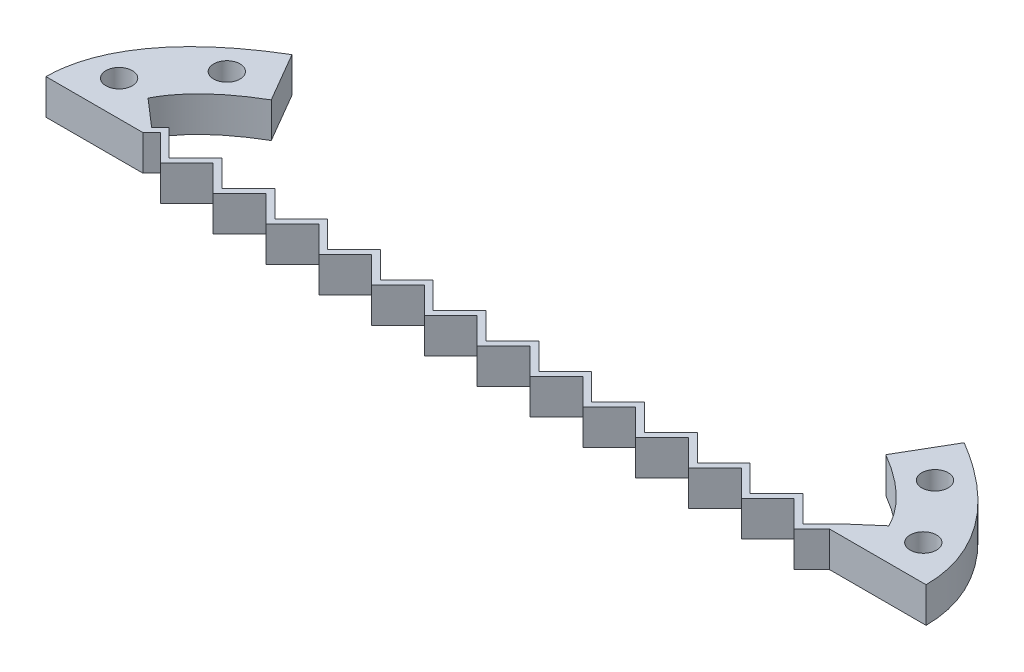
from build123d import *

# Parameters (mm, degrees)
SKETCH_1_R      = 1.5
EXTRUDE_1_DEPTH = 4


with BuildPart() as part:
    # Эскиз1 → Бобышка-Вытянуть1 (new body)
    with BuildSketch(Plane(origin=(0, 0, 0), x_dir=(1, 0, 0), z_dir=(0, 1, 0))):
        with BuildLine():
            Line((-50, 0), (-43, 0))
            Line((-43, 0), (-39, 0))
            Line((-39, 0), (-38, 1))
            Line((-38, 1), (-35, -2))
            Line((-35, -2), (-33, 0))
            Line((-33, 0), (-32, 1))
            Line((-32, 1), (-29, -2))
            Line((-29, -2), (-27, 0))
            Line((-27, 0), (-26, 1))
            Line((-26, 1), (-23, -2))
            Line((-23, -2), (-21, 0))
            Line((-21, 0), (-20, 1))
            Line((-20, 1), (-17, -2))
            Line((-17, -2), (-15, 0))
            Line((-15, 0), (-14, 1))
            Line((-14, 1), (-11, -2))
            Line((-11, -2), (-9, 0))
            Line((-9, 0), (-8, 1))
            Line((-8, 1), (-5, -2))
            Line((-5, -2), (-3, 0))
            Line((-3, 0), (-2, 1))
            Line((-2, 1), (1, -2))
            Line((1, -2), (3, 0))
            Line((3, 0), (4, 1))
            Line((4, 1), (7, -2))
            Line((7, -2), (9, 0))
            Line((9, 0), (10, 1))
            Line((10, 1), (13, -2))
            Line((13, -2), (15, 0))
            Line((15, 0), (16, 1))
            Line((16, 1), (19, -2))
            Line((19, -2), (21, 0))
            Line((21, 0), (22, 1))
            Line((22, 1), (25, -2))
            Line((25, -2), (27, 0))
            Line((27, 0), (28, 1))
            Line((28, 1), (31, -2))
            Line((31, -2), (33, 0))
            Line((33, 0), (34, 1))
            Line((34, 1), (37, -2))
            Line((37, -2), (39, 0))
            Line((39, 0), (43, 0))
            Line((43, 0), (50, 0))
            add(Edge.make_bspline(
                [(50, 0), (50, 9.148701546), (38.189799805, 16.136443156)],
                knots=[6.270008338, 6.270008338, 6.270008338, 6.984807717, 6.984807717, 6.984807717], degree=2, weights=[0.818101322, 0.849400917, 1]))
            Line((38.189799805, 16.136443156), (34.912704057, 10.507753014))
            add(Edge.make_bspline(
                [(42.090540855, 3.682445167), (40.227847319, 7.413208709), (34.912704057, 10.507753014)],
                knots=[0.206034906, 0.206034906, 0.206034906, 0.623356981, 0.623356981, 0.623356981], degree=2, weights=[1, 0.978309158, 1]))
            Line((42.090540855, 3.682445167), (39, 1))
            Line((39, 1), (37, -1))
            Line((37, -1), (34, 2))
            Line((34, 2), (33, 1))
            Line((33, 1), (31, -1))
            Line((31, -1), (28, 2))
            Line((28, 2), (27, 1))
            Line((27, 1), (25, -1))
            Line((25, -1), (22, 2))
            Line((22, 2), (21, 1))
            Line((21, 1), (19, -1))
            Line((19, -1), (16, 2))
            Line((16, 2), (15, 1))
            Line((15, 1), (13, -1))
            Line((13, -1), (10, 2))
            Line((10, 2), (9, 1))
            Line((9, 1), (7, -1))
            Line((7, -1), (4, 2))
            Line((4, 2), (3, 1))
            Line((3, 1), (1, -1))
            Line((1, -1), (-2, 2))
            Line((-2, 2), (-3, 1))
            Line((-3, 1), (-5, -1))
            Line((-5, -1), (-8, 2))
            Line((-8, 2), (-9, 1))
            Line((-9, 1), (-11, -1))
            Line((-11, -1), (-14, 2))
            Line((-14, 2), (-15, 1))
            Line((-15, 1), (-17, -1))
            Line((-17, -1), (-20, 2))
            Line((-20, 2), (-21, 1))
            Line((-21, 1), (-23, -1))
            Line((-23, -1), (-26, 2))
            Line((-26, 2), (-27, 1))
            Line((-27, 1), (-29, -1))
            Line((-29, -1), (-32, 2))
            Line((-32, 2), (-33, 1))
            Line((-33, 1), (-35, -1))
            Line((-35, -1), (-38, 2))
            Line((-38, 2), (-39, 1))
            Line((-39, 1), (-42.090540855, 3.682445167))
            add(Edge.make_bspline(
                [(-34.912704057, 10.507753014), (-40.227846573, 7.413208572), (-42.090540855, 3.682445167)],
                knots=[5.659828256, 5.659828256, 5.659828256, 6.077150244, 6.077150244, 6.077150244], degree=2, weights=[1, 0.978309167, 1]))
            Line((-34.912704057, 10.507753014), (-38.189799805, 16.136443156))
            add(Edge.make_bspline(
                [(-38.189799805, 16.136443156), (-50, 9.148701546), (-50, 0)],
                knots=[2.439970244, 2.439970244, 2.439970244, 3.141592654, 3.141592654, 3.141592654], degree=2, weights=[1, 0.939094243, 1]))
        make_face()
        with Locations(Location((-45.689262056, 3.997292475, 0), (0, 0, 270))):
            Circle(SKETCH_1_R, mode=Mode.SUBTRACT)
        with Locations(Location((-40.232363482, 10.780229305, 0), (0, 0, 270))):
            Circle(SKETCH_1_R, mode=Mode.SUBTRACT)
        with Locations(Location((45.689262056, 3.997292475, 0), (0, 0, 270))):
            Circle(SKETCH_1_R, mode=Mode.SUBTRACT)
        with Locations(Location((40.232363482, 10.780229305, 0), (0, 0, 270))):
            Circle(SKETCH_1_R, mode=Mode.SUBTRACT)
    extrude(amount=EXTRUDE_1_DEPTH)


solid = part.part
